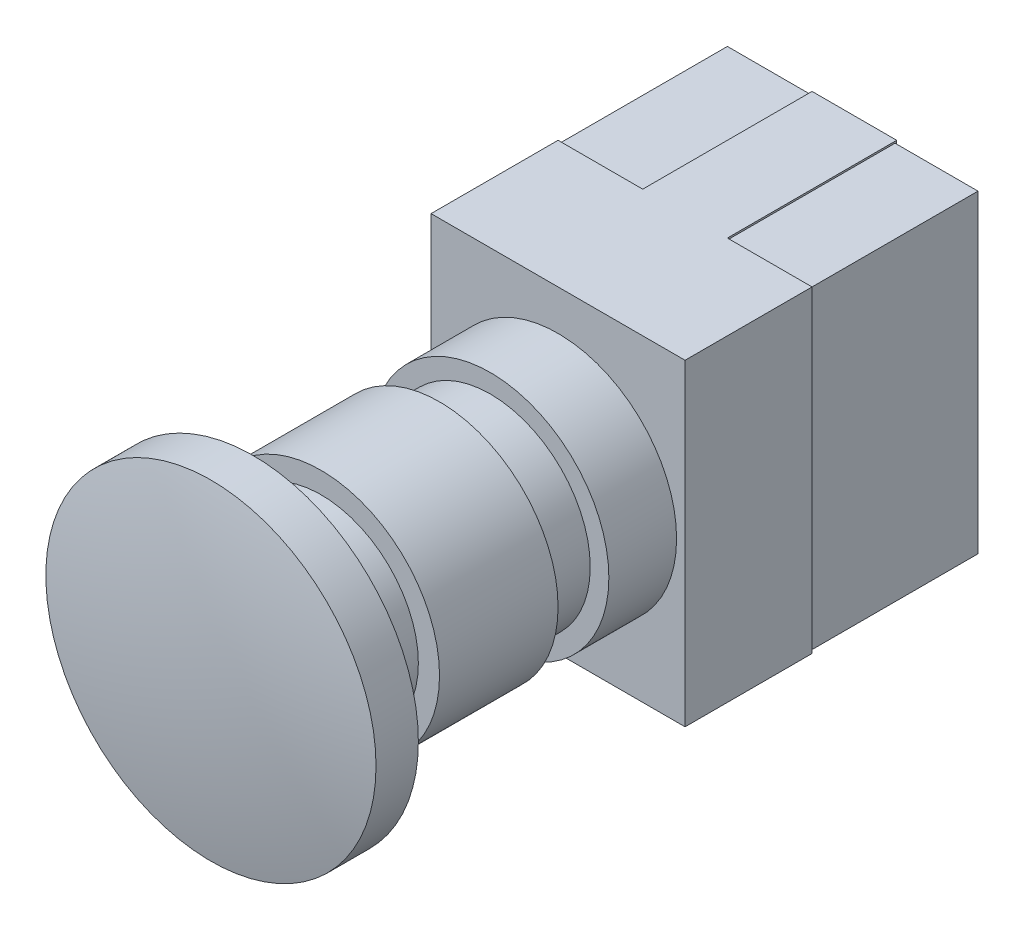
from build123d import *

# Parameters (mm, degrees)
ESQUISSE1_W             = 30
ESQUISSE1_H             = 37.5
BOSS_EXTRU_1_DEPTH      = 35
ESQUISSE2_R             = 14
BOSS_EXTRU_2_DEPTH      = 8
ESQUISSE3_R             = 11.8
BOSS_EXTRU_3_DEPTH      = 6
ESQUISSE4_R             = 14
BOSS_EXTRU_4_DEPTH      = 14
ESQUISSE5_R             = 11.5
BOSS_EXTRU_5_DEPTH      = 8
ENL_V_MAT_EXTRU_1_DEPTH = 20
ESQUISSE9_W             = 9.8
ESQUISSE9_H             = 37.1
ENL_V_MAT_EXTRU_2_DEPTH = 0.2


with BuildPart() as part:
    # Esquisse1 → Boss.-Extru.1 (new body)
    with BuildSketch(Plane.XY):
        Rectangle(ESQUISSE1_W, ESQUISSE1_H)
    extrude(amount=BOSS_EXTRU_1_DEPTH)

    # Esquisse2 → Boss.-Extru.2 (add)
    with BuildSketch(Plane.XY.offset(35)):
        Circle(ESQUISSE2_R)
    extrude(amount=BOSS_EXTRU_2_DEPTH)

    # Esquisse3 → Boss.-Extru.3 (add)
    with BuildSketch(Plane.XY.offset(43)):
        Circle(ESQUISSE3_R)
    extrude(amount=BOSS_EXTRU_3_DEPTH)

    # Esquisse4 → Boss.-Extru.4 (add)
    with BuildSketch(Plane.XY.offset(49)):
        Circle(ESQUISSE4_R)
    extrude(amount=BOSS_EXTRU_4_DEPTH)

    # Esquisse5 → Boss.-Extru.5 (add)
    with BuildSketch(Plane.XY.offset(63)):
        Circle(ESQUISSE5_R)
    extrude(amount=BOSS_EXTRU_5_DEPTH)

    # Esquisse7 → Révolution1 (revolve)
    with BuildSketch(Plane(origin=(0, 0, 0), x_dir=(1, 0, 0), z_dir=(0, 1, 0))):
        with BuildLine():
            Line((0, -71), (12.5, -71))
            Line((12.5, -71), (12.5, -72))
            Line((12.5, -72), (18.5, -72))
            Line((18.5, -72), (18.5, -71))
            Line((18.5, -71), (19.5, -71))
            Line((19.5, -71), (19.5, -76))
            ThreePointArc((19.5, -76), (9.801147892, -77.498691947), (0, -78))
            Line((0, -78), (0, -71))
        make_face()
    revolve(axis=Axis((0, 0, 71), (0, 0, -1)))

    # Esquisse8 → Enlèv. mat.-Extru.1 (cut)
    with BuildSketch(Plane(origin=(0, 0, 0), x_dir=(-1, 0, 0), z_dir=(0, 0, -1))):
        Polygon((-5, 18.75), (-5, 18.55), (-14.8, 18.55), (-14.8, -18.55), (-5, -18.55), (-5, -18.75), (-15, -18.75), (-15, 18.75), align=None)
        Polygon((14.8, -18.55), (5, -18.55), (5, -18.75), (15, -18.75), (15, 18.75), (5, 18.75), (5, 18.55), (14.8, 18.55), align=None)
    extrude(amount=-ENL_V_MAT_EXTRU_1_DEPTH, mode=Mode.SUBTRACT)

    # Esquisse9 → Enlèv. mat.-Extru.2 (cut)
    with BuildSketch(Plane(origin=(0, 0, 0), x_dir=(-1, 0, 0), z_dir=(0, 0, -1))):
        with Locations((-9.9, 0)):
            Rectangle(ESQUISSE9_W, ESQUISSE9_H)
        with Locations((9.9, 0)):
            Rectangle(ESQUISSE9_W, ESQUISSE9_H)
    extrude(amount=-ENL_V_MAT_EXTRU_2_DEPTH, mode=Mode.SUBTRACT)


solid = part.part
